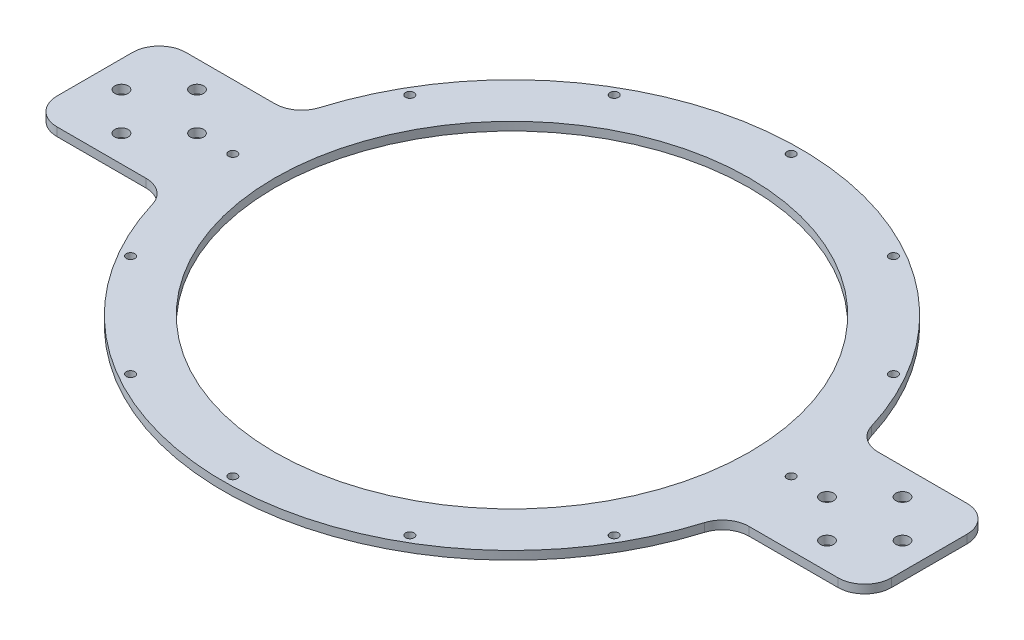
from build123d import *

# Parameters (mm, degrees)
SKETCH1_R              = 107.95
SKETCH1_R_2            = 88.9
BOSS_EXTRUDE1_DEPTH    = 3.175
M3_CLEARANCE_HOLE1_D   = 3.2
CIRPATTERN1_COUNT      = 12
BOSS_EXTRUDE2_DEPTH    = 3.175
F_10_CLEARANCE_HOLE3_D = 4.9784
FILLET1_R              = 10
FILLET1_OF_MIRROR1_R   = 10


with BuildPart() as part:
    # Sketch1 → Boss-Extrude1 (new body)
    with BuildSketch(Plane(origin=(0, 0, 0), x_dir=(1, 0, 0), z_dir=(0, 1, 0))):
        with Locations(Location((0, 0, 0), (0, 0, 270))):
            Circle(SKETCH1_R)
        with Locations(Location((0, 0, 0), (0, 0, 270))):
            Circle(SKETCH1_R_2, mode=Mode.SUBTRACT)
    extrude(amount=BOSS_EXTRUDE1_DEPTH)

    # M3 Clearance Hole1 (through all)
    with Locations(Plane(origin=(0, 3.175, 0), x_dir=(1, 0, 0), z_dir=(0, 1, 0))):
        with Locations((0, 104.55)):
            m3_clearance_hole1 = Hole(M3_CLEARANCE_HOLE1_D / 2)

    # CirPattern1: M3 Clearance Hole1 ×12 about axis
    cirpattern1_axis = Axis((0, 0, 0), (0, 1, 0))
    for i in range(1, CIRPATTERN1_COUNT):
        add(m3_clearance_hole1.rotate(cirpattern1_axis, i * 360 / CIRPATTERN1_COUNT), mode=Mode.SUBTRACT)

    # Sketch2 → Boss-Extrude2 (add)
    with BuildSketch(Plane(origin=(0, 0, 0), x_dir=(1, 0, 0), z_dir=(0, 1, 0))):
        with BuildLine():
            Line((-156.234271247, 24.142135624), (-105.215777275, 24.142135624))
            ThreePointArc((-105.215777275, 24.142135624), (-107.95, 0), (-105.215777275, -24.142135624))
            Line((-105.215777275, -24.142135624), (-156.234271247, -24.142135624))
            Line((-156.234271247, -24.142135624), (-156.234271247, 24.142135624))
        make_face()
    boss_extrude2 = extrude(amount=BOSS_EXTRUDE2_DEPTH)

    # #10 Clearance Hole3 (through all)
    with Locations(Plane(origin=(0, 3.175, 0), x_dir=(1, 0, 0), z_dir=(0, 1, 0))):
        with Locations((-132.092135624, -14.142135624), (-117.95, 0), (-132.092135624, 14.142135624), (-146.234271247, 0)):
            f_10_clearance_hole3 = Hole(F_10_CLEARANCE_HOLE3_D / 2)

    # Fillet1
    fillet1_edges = [part.edges().sort_by_distance(p)[0] for p in [
        (-156.234271247, 1.5875, -24.142135624),
        (-156.234271247, 1.5875, 24.142135624),
        (-105.215777275, 1.5875, 24.142135624),
        (-105.215777275, 1.5875, -24.142135624),
    ]]
    fillet(fillet1_edges, radius=FILLET1_R)

    # Mirror1: Boss-Extrude2, #10 Clearance Hole3 across plane
    add(boss_extrude2.mirror(Plane(origin=(0, 0, 0), x_dir=(0, 0, 1), z_dir=(1, 0, 0))))
    add(f_10_clearance_hole3.mirror(Plane(origin=(0, 0, 0), x_dir=(0, 0, 1), z_dir=(1, 0, 0))), mode=Mode.SUBTRACT)

    # Fillet1 of Mirror1
    fillet1_of_mirror1_edges = [part.edges().sort_by_distance(p)[0] for p in [
        (156.234271247, 1.5875, -24.142135624),
        (156.234271247, 1.5875, 24.142135624),
        (105.215777275, 1.5875, 24.142135624),
        (105.215777275, 1.5875, -24.142135624),
    ]]
    fillet(fillet1_of_mirror1_edges, radius=FILLET1_OF_MIRROR1_R)


solid = part.part
